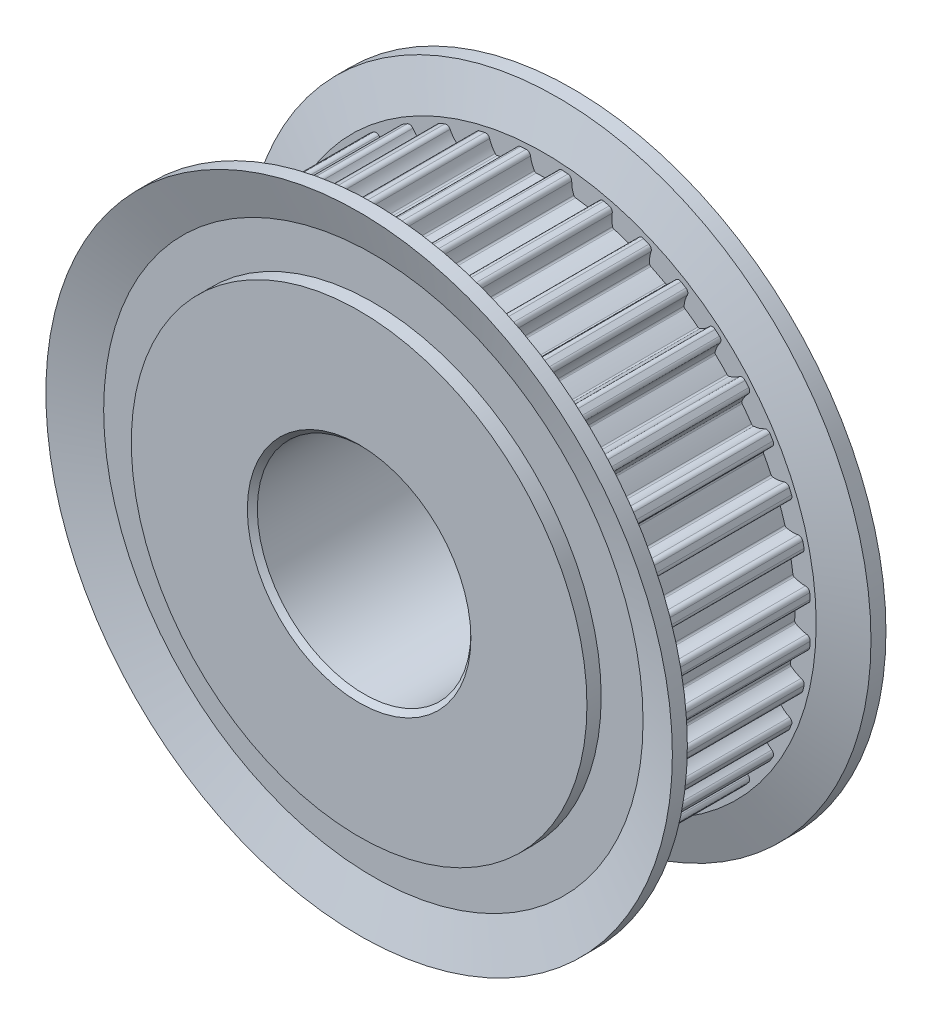
from build123d import *

# Parameters (mm, degrees)
EXTRUDE_1_DEPTH          = 5.5
PATTERN_CIRCULAR_1_COUNT = 40
CUT_EXTRUDE_1_DEPTH      = 33.003906012
CUT_EXTRUDE_1_DEPTH_BACK = 33.003906012
SKETCH_6_R               = 7.5
CHAMFER_1_SIZE           = 0.35


with BuildPart() as part:
    # 草图3 → 旋转1 (revolve)
    with BuildSketch(Plane(origin=(0, 0, 0), x_dir=(0, 0, -1), z_dir=(1, 0, 0))):
        Polygon((7.5, 0), (7.5, 16), (6.5, 16), (6.5, 18.940710283), (7.5, 22), (6.447932451, 22), (5.5, 19.1), (5.5, 17.6), (-5.5, 17.6), (-5.5, 19.1), (-6.447932451, 22), (-7.5, 22), (-6.5, 18.940710283), (-6.5, 16), (-7.5, 16), (-7.5, 0), align=None)
    revolve(axis=Axis((0, 0, 7.5), (0, 0, -1)))

    # 草图4 → 凸台-拉伸1 (add, symmetric)
    with BuildSketch(Plane.XY):
        with BuildLine():
            ThreePointArc((-1.269810781, 18.676883589), (-1.468754272, 18.662292487), (-1.667530989, 18.645582329))
            ThreePointArc((-1.667530989, 18.645582329), (-1.858080179, 18.549812804), (-1.931611409, 18.349628004))
            ThreePointArc((-1.931611409, 18.349628004), (-1.963515241, 17.944424411), (-2.07769221, 17.55433285))
            ThreePointArc((-2.07769221, 17.55433285), (-2.125287008, 17.492018457), (-2.197820984, 17.462233045))
            ThreePointArc((-2.197820984, 17.462233045), (-1.380880085, 17.545745074), (-0.560932924, 17.591058929))
            ThreePointArc((-0.560932924, 17.591058929), (-0.637233351, 17.60913082), (-0.693990297, 17.663232553))
            ThreePointArc((-0.693990297, 17.663232553), (-0.867785323, 18.030660226), (-0.962684173, 18.425884231))
            ThreePointArc((-0.962684173, 18.425884231), (-1.066625913, 18.612101605), (-1.269810781, 18.676883589))
        make_face()
    extrude_1 = extrude(amount=EXTRUDE_1_DEPTH, both=True)

    # 阵列(圆周)1: 凸台-拉伸1 ×40 about axis
    pattern_circular_1_axis = Axis((0, 0, 7.5), (0, 0, 1))
    for i in range(1, PATTERN_CIRCULAR_1_COUNT):
        add(extrude_1.rotate(pattern_circular_1_axis, i * 360 / PATTERN_CIRCULAR_1_COUNT))

    # 草图6 → 切除-拉伸1 (cut, two sides: drawn at the far end of the back side and taken through both)
    with BuildSketch(Plane.XY.offset(-CUT_EXTRUDE_1_DEPTH_BACK)):
        Circle(SKETCH_6_R)
    extrude(amount=CUT_EXTRUDE_1_DEPTH + CUT_EXTRUDE_1_DEPTH_BACK, mode=Mode.SUBTRACT)

    # 倒角1
    chamfer_1_edges = [part.edges().sort_by_distance(p)[0] for p in [
        (-7.5, 0, -7.5),
        (-7.5, 0, 7.5),
    ]]
    chamfer(chamfer_1_edges, length=CHAMFER_1_SIZE)


solid = part.part
